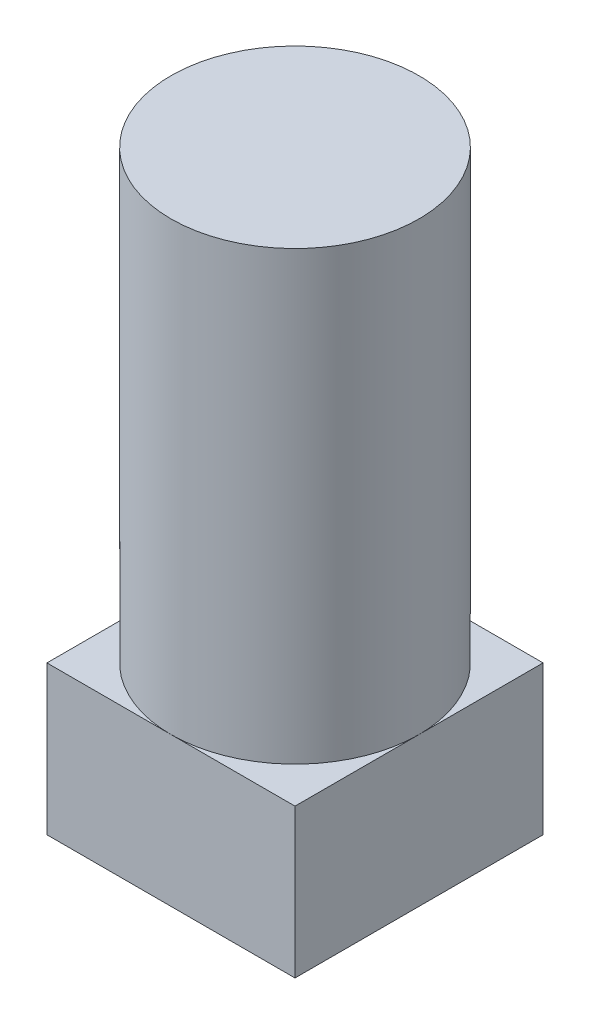
from build123d import *

# Parameters (mm, degrees)
SKETCH2_W           = 254
SKETCH2_H           = 254
BOSS_EXTRUDE1_DEPTH = 152.4
SKETCH3_R           = 127
BOSS_EXTRUDE2_DEPTH = 457.2


with BuildPart() as part:
    # Sketch2 → Boss-Extrude1 (new body)
    with BuildSketch(Plane(origin=(0, 0, 0), x_dir=(1, 0, 0), z_dir=(0, 1, 0))):
        Rectangle(SKETCH2_W, SKETCH2_H)
    extrude(amount=BOSS_EXTRUDE1_DEPTH)

    # Sketch3 → Boss-Extrude2 (add)
    with BuildSketch(Plane(origin=(0, 152.4, 0), x_dir=(1, 0, 0), z_dir=(0, 1, 0))):
        with Locations(Location((0, 0, 0), (0, 0, 270))):
            Circle(SKETCH3_R)
    extrude(amount=BOSS_EXTRUDE2_DEPTH)


solid = part.part
